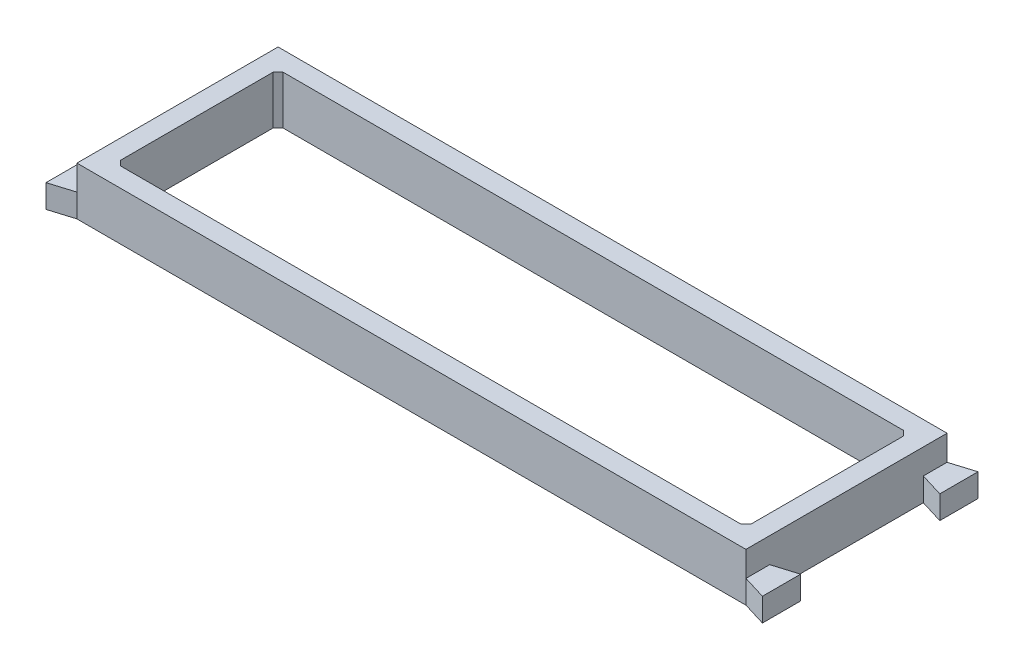
from build123d import *

# Parameters (mm, degrees)
SKETCH1_W           = 138.3
SKETCH1_H           = 41.58498921
BOSS_EXTRUDE1_DEPTH = 10
BOSS_EXTRUDE2_DEPTH = 4.8


with BuildPart() as part:
    # Sketch1 → Boss-Extrude1 (new body)
    with BuildSketch(Plane(origin=(0, 0, 0), x_dir=(1, 0, 0), z_dir=(0, 1, 0))):
        Rectangle(SKETCH1_W, SKETCH1_H)
        Polygon((-64.15, 16.792494605), (64.15, 16.792494605), (65.15, 15.792494605), (65.15, -15.792494605), (64.15, -16.792494605), (-64.15, -16.792494605), (-65.15, -15.792494605), (-65.15, 15.792494605), align=None, mode=Mode.SUBTRACT)
    extrude(amount=BOSS_EXTRUDE1_DEPTH)

    # Sketch3 → Boss-Extrude2 (add)
    with BuildSketch(Plane.XZ):
        Polygon((74.05, 22.283333333), (69.15, 20.783333333), (69.15, 15.883333333), (74.05, 14.383333333), align=None)
        Polygon((74.05, -14.383333333), (69.15, -15.883333333), (69.15, -20.783333333), (74.05, -22.283333333), align=None)
        Polygon((-74.05, 22.283333333), (-69.15, 20.783333333), (-69.15, 15.883333333), (-74.05, 14.383333333), align=None)
        Polygon((-74.05, -14.383333333), (-69.15, -15.883333333), (-69.15, -20.783333333), (-74.05, -22.283333333), align=None)
    extrude(amount=-BOSS_EXTRUDE2_DEPTH)


solid = part.part
